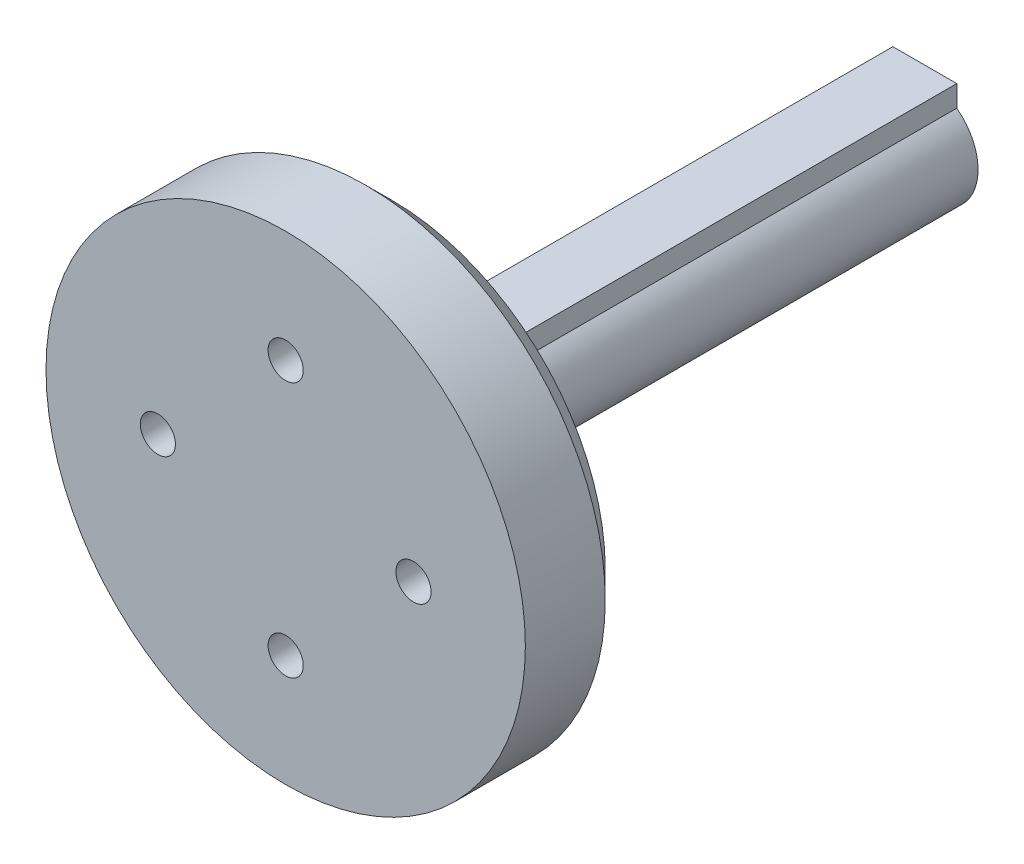
from build123d import *

# Parameters (mm, degrees)
SKETCH8_R           = 22.5
SKETCH8_R_2         = 1.65
BOSS_EXTRUDE5_DEPTH = 10
SKETCH9_R           = 3.65
CUT_EXTRUDE1_DEPTH  = 5
BOSS_EXTRUDE6_DEPTH = 50
FILLET1_R           = 1
CHAMFER1_SIZE       = 2.5


with BuildPart() as part:
    # Sketch8 → Boss-Extrude5 (new body)
    with BuildSketch(Plane(origin=(-41, 0, 0), x_dir=(-1, 0, 0), z_dir=(0, 0, -1))):
        with Locations((-17.5, 0)):
            Circle(SKETCH8_R)
        with Locations((-17.5, 12)):
            Circle(SKETCH8_R_2, mode=Mode.SUBTRACT)
        with Locations((-5.5, 0)):
            Circle(SKETCH8_R_2, mode=Mode.SUBTRACT)
        with Locations((-17.5, -12)):
            Circle(SKETCH8_R_2, mode=Mode.SUBTRACT)
        with Locations((-29.5, 0)):
            Circle(SKETCH8_R_2, mode=Mode.SUBTRACT)
    extrude(amount=BOSS_EXTRUDE5_DEPTH)

    # Sketch9 → Cut-Extrude1 (cut, symmetric)
    with BuildSketch(Plane(origin=(0, 0, -10), x_dir=(-1, 0, 0), z_dir=(0, 0, -1))):
        with Locations((23.5, 12)):
            Circle(SKETCH9_R)
        with Locations((11.5, 0)):
            Circle(SKETCH9_R)
        with Locations((35.5, 0)):
            Circle(SKETCH9_R)
        with Locations((23.5, -12)):
            Circle(SKETCH9_R)
    extrude(amount=CUT_EXTRUDE1_DEPTH, both=True, mode=Mode.SUBTRACT)

    # Sketch10 → Boss-Extrude6 (add)
    with BuildSketch(Plane(origin=(0, 0, -10), x_dir=(-1, 0, 0), z_dir=(0, 0, -1))):
        with BuildLine():
            Line((20.5, 6), (26.5, 6))
            Line((26.5, 6), (26.5, 4))
            ThreePointArc((26.5, 4), (23.5, -5), (20.5, 4))
            Line((20.5, 4), (20.5, 6))
        make_face()
    extrude(amount=BOSS_EXTRUDE6_DEPTH)

    # Fillet1
    fillet1_edges = [part.edges().sort_by_distance(p)[0] for p in [
        (-23.5, -5, -10),
        (-26.5, 5, -10),
        (-23.5, 6, -10),
        (-20.5, 5, -10),
    ]]
    fillet(fillet1_edges, radius=FILLET1_R)

    # Chamfer1
    chamfer1_edges = [part.edges().sort_by_distance(p)[0] for p in [
        (-1, 0, -10),
    ]]
    chamfer(chamfer1_edges, length=CHAMFER1_SIZE)


solid = part.part
